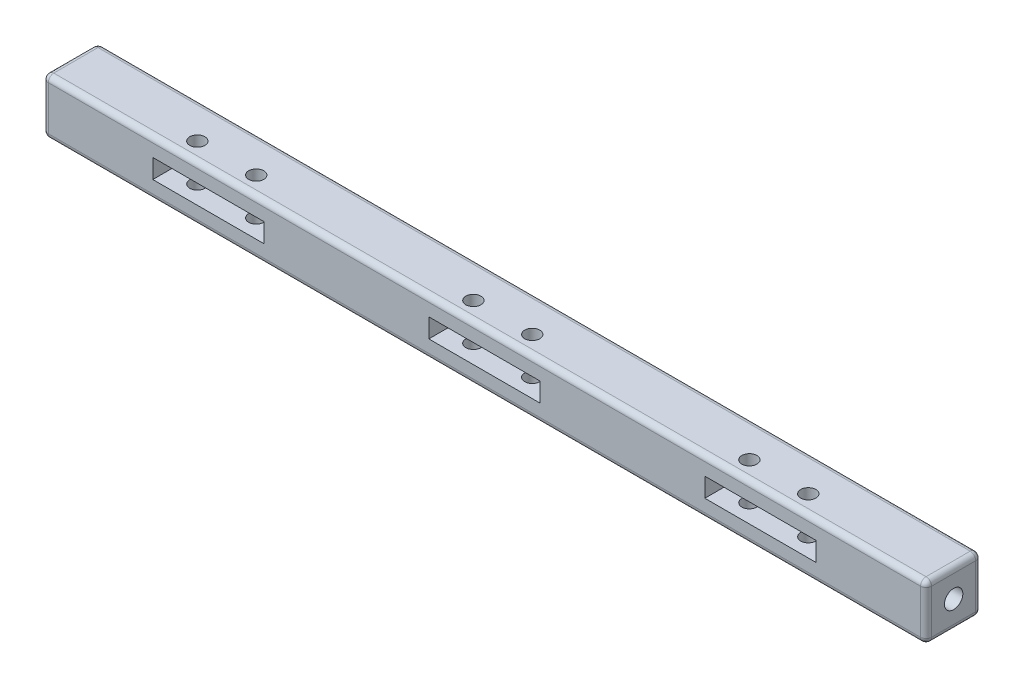
from build123d import *

# Parameters (mm, degrees)
BOSS_EXTRU_1_DEPTH      = 120
ESQUISSE2_W             = 30.2
ESQUISSE2_H             = 5.2
ENL_V_MAT_EXTRU_1_DEPTH = 10
ESQUISSE3_R             = 2.05
ENL_V_MAT_EXTRU_2_DEPTH = 121.657614762
CONG_2_R                = 1.5
ESQUISSE4_R             = 2.5
ENL_V_MAT_EXTRU_3_DEPTH = 5
CONG_2_OF_SYM_TRIE6_R   = 1.5


with BuildPart() as part:
    # Esquisse1 → Boss.-Extru.1 (new body)
    with BuildSketch(Plane(origin=(0, 0, 0), x_dir=(0, 0, -1), z_dir=(1, 0, 0))):
        with BuildLine():
            Line((6, 7.5), (-6, 7.5))
            ThreePointArc((-6, 7.5), (-7.060660172, 7.060660172), (-7.5, 6))
            Line((-7.5, 6), (-7.5, -6))
            ThreePointArc((-7.5, -6), (-7.060660172, -7.060660172), (-6, -7.5))
            Line((-6, -7.5), (6, -7.5))
            ThreePointArc((6, -7.5), (7.060660172, -7.060660172), (7.5, -6))
            Line((7.5, -6), (7.5, 6))
            ThreePointArc((7.5, 6), (7.060660172, 7.060660172), (6, 7.5))
        make_face()
    boss_extru_1 = extrude(amount=BOSS_EXTRU_1_DEPTH)

    # Esquisse2 → Enlèv. mat.-Extru.1 (cut)
    with BuildSketch(Plane.XY.offset(7.5)):
        Rectangle(ESQUISSE2_W, ESQUISSE2_H)
        with Locations((75, 0)):
            Rectangle(ESQUISSE2_W, ESQUISSE2_H)
    enl_v_mat_extru_1 = extrude(amount=-ENL_V_MAT_EXTRU_1_DEPTH, mode=Mode.SUBTRACT)

    # Esquisse3 → Enlèv. mat.-Extru.2 (cut, symmetric)
    with BuildSketch(Plane(origin=(0, -2.6, 0), x_dir=(1, 0, 0), z_dir=(0, 1, 0))):
        with Locations(Location((8, -2.5, 0), (0, 0, 180))):
            Circle(ESQUISSE3_R)
        with Locations(Location((67, -2.5, 0), (0, 0, 180))):
            Circle(ESQUISSE3_R)
        with Locations((83, -2.5)):
            Circle(ESQUISSE3_R)
    enl_v_mat_extru_2 = extrude(amount=ENL_V_MAT_EXTRU_2_DEPTH, both=True, mode=Mode.SUBTRACT)

    # Congé2
    cong_2_edges = [part.edges().sort_by_distance(p)[0] for p in [
        (120, 7.060660172, 7.060660172),
        (120, 0, 7.5),
        (120, -7.060660172, 7.060660172),
        (120, -7.5, 0),
        (120, -7.060660172, -7.060660172),
        (120, 0, -7.5),
        (120, 7.060660172, -7.060660172),
        (120, 7.5, 0),
    ]]
    fillet(cong_2_edges, radius=CONG_2_R)

    # Esquisse4 → Enlèv. mat.-Extru.3 (cut)
    with BuildSketch(Plane(origin=(120, 0, 0), x_dir=(0, 0, -1), z_dir=(1, 0, 0))):
        Circle(ESQUISSE4_R)
    enl_v_mat_extru_3 = extrude(amount=-ENL_V_MAT_EXTRU_3_DEPTH, mode=Mode.SUBTRACT)

    # Symétrie6: Boss.-Extru.1, Enlèv. mat.-Extru.1, Enlèv. mat.-Extru.2, Enlèv. mat.-Extru.3 across plane
    add(boss_extru_1.mirror(Plane(origin=(0, 6, -6), x_dir=(0, 0, 1), z_dir=(-1, 0, 0))))
    add(enl_v_mat_extru_1.mirror(Plane(origin=(0, 6, -6), x_dir=(0, 0, 1), z_dir=(-1, 0, 0))), mode=Mode.SUBTRACT)
    add(enl_v_mat_extru_2.mirror(Plane(origin=(0, 6, -6), x_dir=(0, 0, 1), z_dir=(-1, 0, 0))), mode=Mode.SUBTRACT)
    add(enl_v_mat_extru_3.mirror(Plane(origin=(0, 6, -6), x_dir=(0, 0, 1), z_dir=(-1, 0, 0))), mode=Mode.SUBTRACT)

    # Congé2 of Symétrie6
    cong_2_of_sym_trie6_edges = [part.edges().sort_by_distance(p)[0] for p in [
        (-120, 7.060660172, 7.060660172),
        (-120, 0, 7.5),
        (-120, -7.060660172, 7.060660172),
        (-120, -7.5, 0),
        (-120, -7.060660172, -7.060660172),
        (-120, 0, -7.5),
        (-120, 7.060660172, -7.060660172),
        (-120, 7.5, 0),
    ]]
    fillet(cong_2_of_sym_trie6_edges, radius=CONG_2_OF_SYM_TRIE6_R)


solid = part.part
